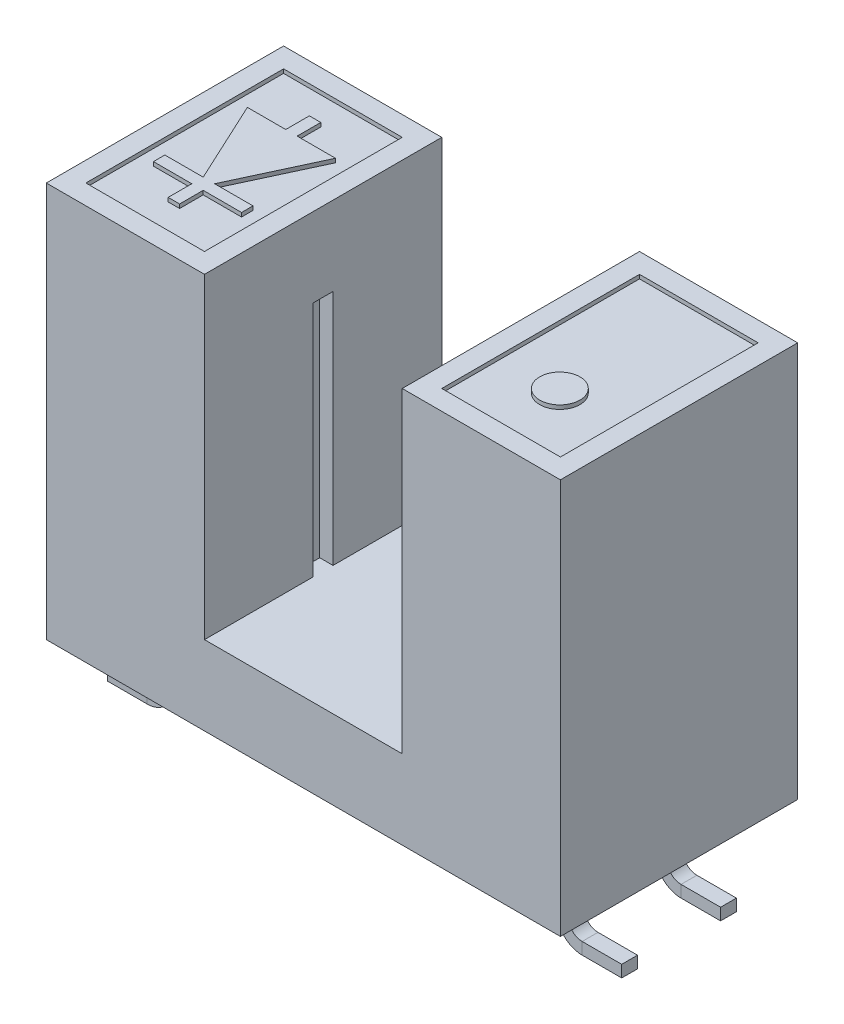
from build123d import *

# Parameters (mm, degrees)
BASE_DEPTH      = 3
SKETCH2_W       = 3
SKETCH2_H       = 5
SKETCH2_R       = 0.509076859
POLARITY_DEPTH  = 0.1
SKETCH3_W       = 0.671157402
SKETCH3_H       = 0.5
SKETCH3_W_2     = 0.596513076
LIGHTSLOT_DEPTH = 6
SKETCH4_W       = 0.3
SKETCH4_H       = 0.4


with BuildPart() as part:
    # Sketch1 → Base (new, symmetric)
    with BuildSketch(Plane.XY):
        Polygon((6.5, 0), (-6.5, 0), (-6.5, 10), (-2.5, 10), (-2.5, 2), (2.5, 2), (2.5, 10), (6.5, 10), align=None)
    extrude(amount=BASE_DEPTH, both=True)

    # Sketch2 → Polarity (cut)
    # profile 1 of 2: a face of its own
    with BuildSketch(Plane(origin=(0, 10, 0), x_dir=(1, 0, 0), z_dir=(0, 1, 0))):
        with Locations((-4.5, 0)):
            Rectangle(SKETCH2_W, SKETCH2_H)
        Polygon((-4.644390506, 1.198307086), (-5.614083966, 1.198307086), (-4.644390506, -0.88812109), (-5.614083966, -0.88812109), (-5.614083966, -1.176902103), (-4.644390506, -1.176902103), (-4.644390506, -1.773829525), (-4.355609494, -1.773829525), (-4.355609494, -1.176902103), (-3.385916034, -1.176902103), (-3.385916034, -0.88812109), (-4.355609494, -0.88812109), (-3.385916034, 1.198307086), (-4.355609494, 1.198307086), (-4.355609494, 1.796472229), (-4.644390506, 1.796472229), align=None, mode=Mode.SUBTRACT)
    # profile 2 of 2: a face of its own
    with BuildSketch(Plane(origin=(0, 10, 0), x_dir=(1, 0, 0), z_dir=(0, 1, 0))):
        with Locations((4.5, 0)):
            Rectangle(SKETCH2_W, SKETCH2_H)
        with Locations(Location((4.492051803, -1.006853172, 0), (0, 0, 180))):
            Circle(SKETCH2_R, mode=Mode.SUBTRACT)
    extrude(amount=-POLARITY_DEPTH, mode=Mode.SUBTRACT)

    # Sketch3 → LightSlot (cut)
    with BuildSketch(Plane(origin=(0, 2, 0), x_dir=(1, 0, 0), z_dir=(0, 1, 0))):
        with Locations((-2.5, 0)):
            Rectangle(SKETCH3_W, SKETCH3_H)
        with Locations((2.5, 0)):
            Rectangle(SKETCH3_W_2, SKETCH3_H)
    extrude(amount=LIGHTSLOT_DEPTH, mode=Mode.SUBTRACT)

    # Sweep1: sweep along a curve in space
    with BuildLine() as sweep1_path:
        Line((5, 0, 1.25), (5, -1.034487075, 1.25))
        ThreePointArc((5, -1.034487075, 1.25), (5.146446609, -1.388040466, 1.25), (5.5, -1.534487075, 1.25))
        Line((5.5, -1.534487075, 1.25), (6.5, -1.534487075, 1.25))
    # Sketch4 → Sweep1 (sweep)
    with BuildSketch(Plane.XZ):
        with Locations((5, 1.25)):
            Rectangle(SKETCH4_W, SKETCH4_H)
        with Locations((5, -1.25)):
            Rectangle(SKETCH4_W, SKETCH4_H)
    sweep1 = sweep(path=sweep1_path.line)

    # Mirror1: Sweep1 across plane
    add(sweep1.mirror(Plane(origin=(0, 0, 0), x_dir=(0, 0, 1), z_dir=(1, 0, 0))))


solid = part.part
